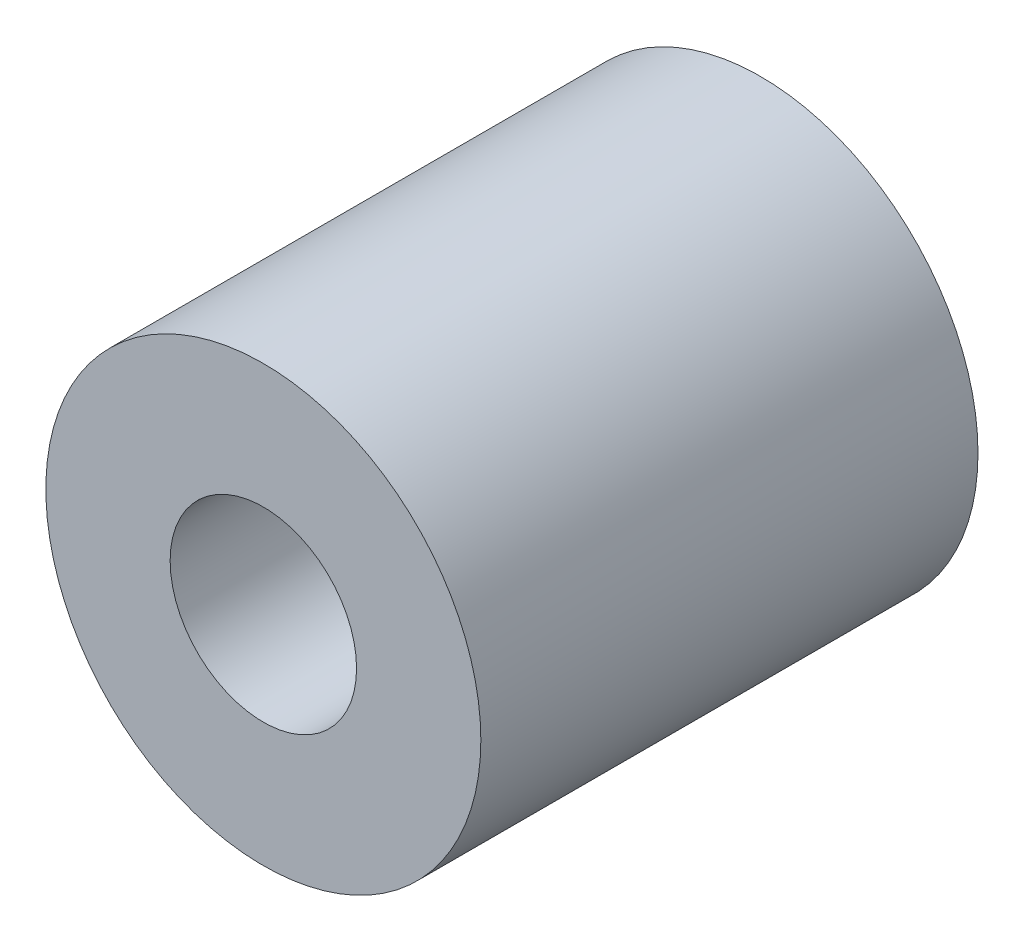
from build123d import *

# Parameters (mm, degrees)
SKETCH1_R           = 3.5
SKETCH1_R_2         = 1.5
BOSS_EXTRUDE1_DEPTH = 8


with BuildPart() as part:
    # Sketch1 → Boss-Extrude1 (new body)
    with BuildSketch(Plane.XY):
        Circle(SKETCH1_R)
        Circle(SKETCH1_R_2, mode=Mode.SUBTRACT)
    extrude(amount=BOSS_EXTRUDE1_DEPTH)


solid = part.part
